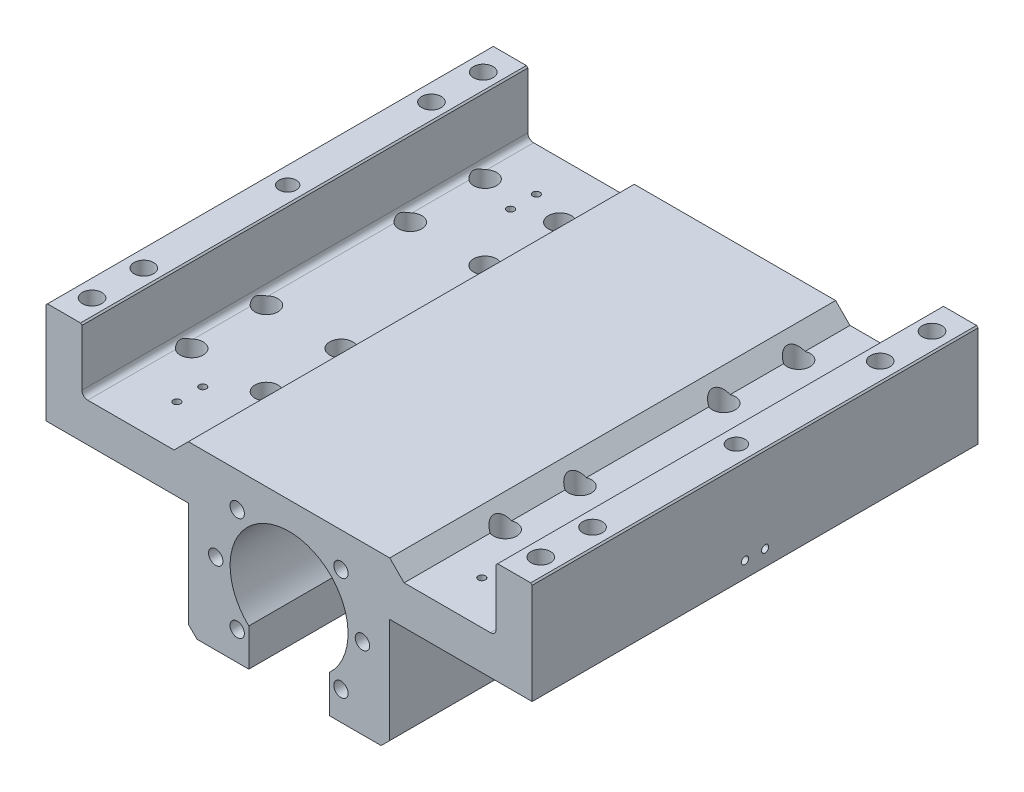
from build123d import *

# Parameters (mm, degrees)
EXTRUDE_1_DEPTH           = 155
SKETCH_2_R                = 20.5
CUT_EXTRUDE_1_DEPTH       = 100
HOLE_WIZARD_M6_1_D        = 5
HOLE_WIZARD_M6_1_DEPTH    = 20
HOLE_WIZARD_M6_1_TIP      = 1.502151548
HOLE_WIZARD_M3_1_D        = 2.5
HOLE_WIZARD_M3_1_DEPTH    = 4
HOLE_WIZARD_M3_1_TIP      = 0.751075774
HOLE_WIZARD_M3_2_D        = 2.5
HOLE_WIZARD_M3_2_DEPTH    = 7.5
HOLE_WIZARD_M3_2_TIP      = 0.751075774
HOLE_WIZARD_M8_1_D        = 6.8
HOLE_WIZARD_M8_1_DEPTH    = 20
HOLE_WIZARD_M8_1_TIP      = 2.042926105
HOLE_WIZARD_M3_3_D        = 2.5
HOLE_WIZARD_M3_3_DEPTH    = 8
HOLE_WIZARD_M3_3_TIP      = 0.751075774
HOLE_WIZARD_3_D           = 4
HOLE_WIZARD_3_CBORE_D     = 8
HOLE_WIZARD_3_CBORE_DEPTH = 11
HOLE_WIZARD_6_0_6_1_D     = 6
HOLE_WIZARD_6_0_6_1_DEPTH = 6
HOLE_WIZARD_6_0_6_1_TIP   = 1.802581857


with BuildPart() as part:
    # 草图1 → 凸台-拉伸1 (new body)
    with BuildSketch(Plane.XY):
        with BuildLine():
            Line((410.755201714, 671.743765912), (410.255201714, 671.243765912))
            Line((410.255201714, 671.243765912), (410.255201714, 636.243765912))
            Line((410.255201714, 636.243765912), (459.755201714, 636.243765912))
            Line((459.755201714, 636.243765912), (459.755201714, 599.743765912))
            Line((459.755201714, 599.743765912), (462.755201714, 596.743765912))
            Line((462.755201714, 596.743765912), (480.755201714, 596.743765912))
            Line((480.755201714, 596.743765912), (480.755201714, 612.650626269))
            ThreePointArc((480.755201714, 612.650626269), (494.755201714, 643.244012891), (508.755201714, 612.650626269))
            Line((508.755201714, 612.650626269), (508.755201714, 596.743765912))
            Line((508.755201714, 596.743765912), (526.755201714, 596.743765912))
            Line((526.755201714, 596.743765912), (529.755201714, 599.743765912))
            Line((529.755201714, 599.743765912), (529.755201714, 636.243765912))
            Line((529.755201714, 636.243765912), (579.255201714, 636.243765912))
            Line((579.255201714, 636.243765912), (579.255201714, 671.243765912))
            Line((579.255201714, 671.243765912), (578.755201714, 671.743765912))
            Line((578.755201714, 671.743765912), (567.255201714, 671.743765912))
            Line((567.255201714, 671.743765912), (566.755201714, 671.243765912))
            Line((566.755201714, 671.243765912), (566.755201714, 651.743765912))
            ThreePointArc((566.755201714, 651.743765912), (566.169415276, 650.32955235), (564.755201714, 649.743765912))
            Line((564.755201714, 649.743765912), (534.755201714, 649.743765912))
            Line((534.755201714, 649.743765912), (529.755201714, 654.743765912))
            Line((529.755201714, 654.743765912), (459.755201714, 654.743765912))
            Line((459.755201714, 654.743765912), (454.755201714, 649.743765912))
            Line((454.755201714, 649.743765912), (424.755201714, 649.743765912))
            ThreePointArc((424.755201714, 649.743765912), (423.340988151, 650.32955235), (422.755201714, 651.743765912))
            Line((422.755201714, 651.743765912), (422.755201714, 671.243765912))
            Line((422.755201714, 671.243765912), (422.255201714, 671.743765912))
            Line((422.255201714, 671.743765912), (410.755201714, 671.743765912))
        make_face()
    extrude(amount=EXTRUDE_1_DEPTH)

    # 草图2 → 切除-拉伸1 (cut)
    with BuildSketch(Plane.XY.offset(155)):
        with Locations((494.755201714, 624.744012891)):
            Circle(SKETCH_2_R)
    extrude(amount=-CUT_EXTRUDE_1_DEPTH, mode=Mode.SUBTRACT)

    # M6 螺纹孔1
    with Locations(Plane(origin=(476.723978793, 642.775235811, 155), x_dir=(1, 0, 0), z_dir=(0, 0, 1))):
        with Locations((0, 0), (-7.468777079, -18.03122292), (0, -36.06244584), (36.062445841, -36.06244584), (43.531222921, -18.03122292), (36.062445841, 0)):
            Hole(HOLE_WIZARD_M6_1_D / 2, depth=HOLE_WIZARD_M6_1_DEPTH)
            with Locations((0, 0, -(HOLE_WIZARD_M6_1_DEPTH + HOLE_WIZARD_M6_1_TIP / 2))):  # 118° drill point
                Cone(0, HOLE_WIZARD_M6_1_D / 2, HOLE_WIZARD_M6_1_TIP, mode=Mode.SUBTRACT)

    # M3 螺纹孔1
    with Locations(Plane.ZY.offset(-410.255201714)):
        with Locations((74, 641.743765912), (81, 641.743765912)):
            Hole(HOLE_WIZARD_M3_1_D / 2, depth=HOLE_WIZARD_M3_1_DEPTH)
            with Locations((0, 0, -(HOLE_WIZARD_M3_1_DEPTH + HOLE_WIZARD_M3_1_TIP / 2))):  # 118° drill point
                Cone(0, HOLE_WIZARD_M3_1_D / 2, HOLE_WIZARD_M3_1_TIP, mode=Mode.SUBTRACT)

    # M3 螺纹孔2
    with Locations(Plane(origin=(579.255201714, 0, 0), x_dir=(0, 0, -1), z_dir=(1, 0, 0))):
        with Locations((-74, 641.743765912), (-81, 641.743765912)):
            Hole(HOLE_WIZARD_M3_2_D / 2, depth=HOLE_WIZARD_M3_2_DEPTH)
            with Locations((0, 0, -(HOLE_WIZARD_M3_2_DEPTH + HOLE_WIZARD_M3_2_TIP / 2))):  # 118° drill point
                Cone(0, HOLE_WIZARD_M3_2_D / 2, HOLE_WIZARD_M3_2_TIP, mode=Mode.SUBTRACT)

    # M8 螺纹孔1
    with Locations(Plane(origin=(0, 671.743765912, 0), x_dir=(1, 0, 0), z_dir=(0, 1, 0))):
        with Locations((572.755201714, -9.5), (572.755201714, -27.5), (572.755201714, -127.5), (572.755201714, -145.5), (416.755201714, -145.5), (416.755201714, -127.5), (416.755201714, -27.5), (416.755201714, -9.5)):
            Hole(HOLE_WIZARD_M8_1_D / 2, depth=HOLE_WIZARD_M8_1_DEPTH)
            with Locations((0, 0, -(HOLE_WIZARD_M8_1_DEPTH + HOLE_WIZARD_M8_1_TIP / 2))):  # 118° drill point
                Cone(0, HOLE_WIZARD_M8_1_D / 2, HOLE_WIZARD_M8_1_TIP, mode=Mode.SUBTRACT)

    # M3 螺纹孔3
    with Locations(Plane(origin=(440.755201714, 649.743765912, 15), x_dir=(0, 0, 1), z_dir=(0, 1, 0))):
        with Locations((0, 0), (9, 0), (116, 0), (125, 0), (116, 106), (125, 106), (0, 106), (9, 106)):
            Hole(HOLE_WIZARD_M3_3_D / 2, depth=HOLE_WIZARD_M3_3_DEPTH)
            with Locations((0, 0, -(HOLE_WIZARD_M3_3_DEPTH + HOLE_WIZARD_M3_3_TIP / 2))):  # 118° drill point
                Cone(0, HOLE_WIZARD_M3_3_D / 2, HOLE_WIZARD_M3_3_TIP, mode=Mode.SUBTRACT)

    # 打孔尺寸根据内六角圆柱头螺钉的类型3 (through all)
    with Locations(Plane(origin=(427.255201714, 654.743765912, 19.364916731), x_dir=(0, 0, 1), z_dir=(0, 1, 0))):
        with Locations((0, 0), (26, 0), (0, 135), (26, 135), (76, 135), (102, 135), (76, 0), (102, 0), (0, 109), (26, 109), (0, 26), (26, 26), (76, 26), (102, 26), (76, 109), (102, 109)):
            CounterBoreHole(HOLE_WIZARD_3_D / 2, HOLE_WIZARD_3_CBORE_D / 2, HOLE_WIZARD_3_CBORE_DEPTH)

    # Ø6.0 (6) 直径孔1
    with Locations(Plane(origin=(0, 671.743765912, 0), x_dir=(1, 0, 0), z_dir=(0, 1, 0))):
        with Locations((416.755201714, -77.5), (572.755201714, -77.5)):
            Hole(HOLE_WIZARD_6_0_6_1_D / 2, depth=HOLE_WIZARD_6_0_6_1_DEPTH)
            with Locations((0, 0, -(HOLE_WIZARD_6_0_6_1_DEPTH + HOLE_WIZARD_6_0_6_1_TIP / 2))):  # 118° drill point
                Cone(0, HOLE_WIZARD_6_0_6_1_D / 2, HOLE_WIZARD_6_0_6_1_TIP, mode=Mode.SUBTRACT)


solid = part.part
